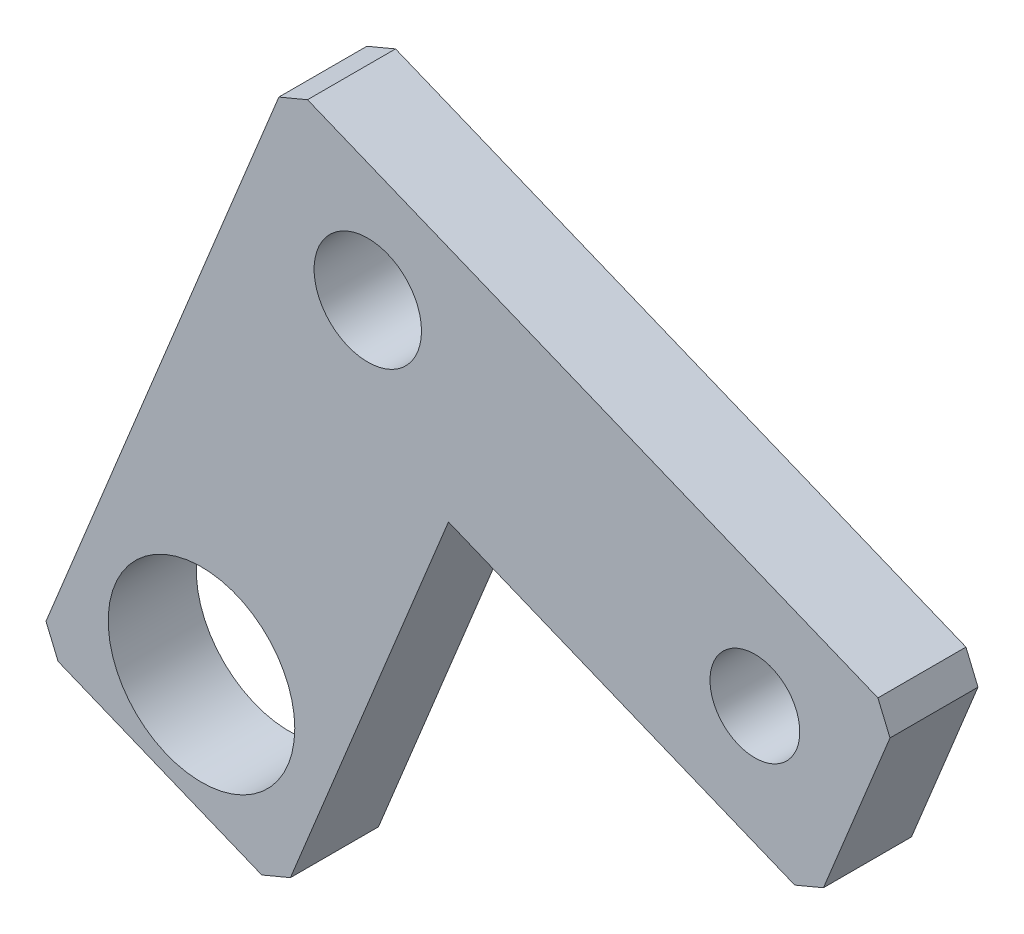
from build123d import *

# Parameters (mm, degrees)
SKETCH_1_R      = 5.1
SKETCH_1_R_2    = 6.1
SKETCH_1_R_3    = 10.6
EXTRUDE_1_DEPTH = 10
CHAMFER_1_SIZE  = 2.5


with BuildPart() as part:
    # 草圖1 → 填料-伸長1 (new body)
    with BuildSketch(Plane.XY):
        Polygon((-42.684704159, 14.950876454), (26.753169389, -13.39311263), (17.305173028, -36.539070479), (-24.357551101, -19.532677029), (-43.253543823, -65.824592728), (-71.028693242, -54.486997094), align=None)
        with Locations((10.456192284, -20.242093374)):
            Circle(SKETCH_1_R, mode=Mode.SUBTRACT)
        with Locations((-33.52112763, -2.290900288)):
            Circle(SKETCH_1_R_2, mode=Mode.SUBTRACT)
        with Locations((-52.417120352, -48.582815986)):
            Circle(SKETCH_1_R_3, mode=Mode.SUBTRACT)
    extrude(amount=-EXTRUDE_1_DEPTH)

    # 導角1
    chamfer_1_edges = [part.edges().sort_by_distance(p)[0] for p in [
        (-42.684704159, 14.950876454, -5),
        (26.753169389, -13.39311263, -5),
        (17.305173028, -36.539070479, -5),
        (-43.253543823, -65.824592728, -5),
        (-71.028693242, -54.486997094, -5),
    ]]
    chamfer(chamfer_1_edges, length=CHAMFER_1_SIZE)


solid = part.part
